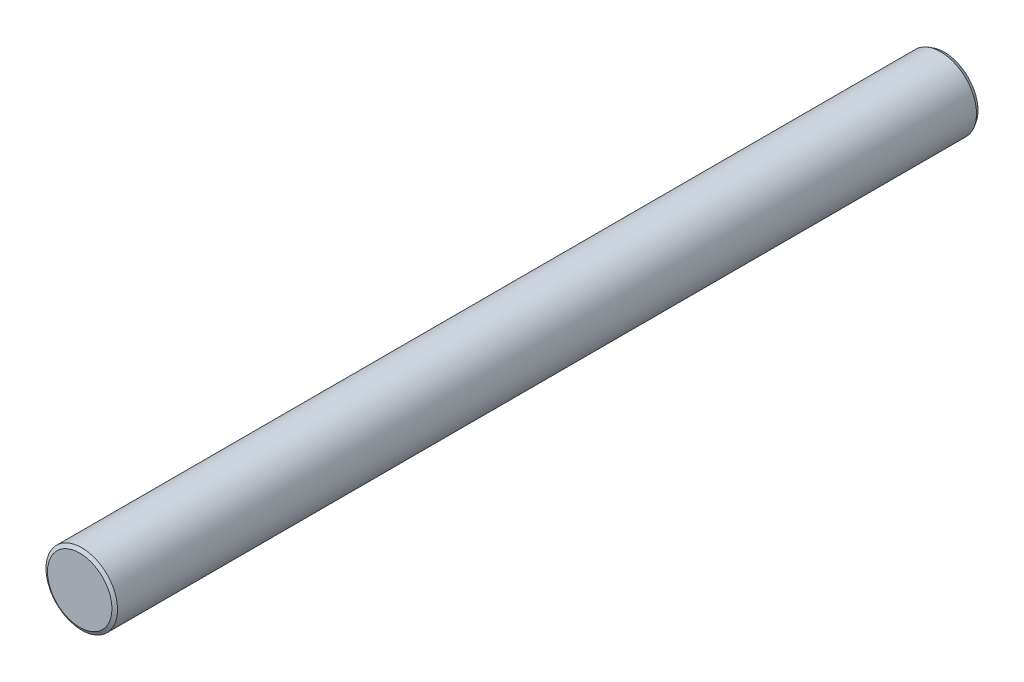
from build123d import *
from OCP.BRepFilletAPI import BRepFilletAPI_MakeChamfer

# Parameters (mm, degrees)
SKETCH1_R           = 3.475
BOSS_EXTRUDE1_DEPTH = 42
CHAMFER1_SIZE       = 0.2
CHAMFER1_SIZE2      = 0.346410162


with BuildPart() as part:
    # Sketch1 → Boss-Extrude1 (new, symmetric)
    with BuildSketch(Plane.XY):
        with Locations(Location((0, 0, 0), (0, 0, 180))):
            Circle(SKETCH1_R)
    extrude(amount=BOSS_EXTRUDE1_DEPTH, both=True)

    # Chamfer1: one chamfer whose edges measure the first distance from different faces: ONE call of the kernel's chamfer builder (chamfer() names one face for all edges)
    chamfer1_edges_1 = [part.edges().sort_by_distance(p)[0] for p in [
        (3.475, 0, -42),
    ]]
    chamfer1_side_1 = [part.faces().sort_by_distance(p)[0] for p in [
        (0, 0, -42),
    ]]
    chamfer1_edges_2 = [part.edges().sort_by_distance(p)[0] for p in [
        (3.475, 0, 42),
    ]]
    chamfer1_side_2 = [part.faces().sort_by_distance(p)[0] for p in [
        (3.475, 0, 0),
    ]]
    chamfer1 = BRepFilletAPI_MakeChamfer(part.part.solid().wrapped)
    for e in chamfer1_edges_1:
        chamfer1.Add(CHAMFER1_SIZE, CHAMFER1_SIZE2, e.wrapped, chamfer1_side_1[0].wrapped)  # the first distance lies on this face
    for e in chamfer1_edges_2:
        chamfer1.Add(CHAMFER1_SIZE, CHAMFER1_SIZE2, e.wrapped, chamfer1_side_2[0].wrapped)  # the first distance lies on this face
    add(Compound.cast(chamfer1.Shape()), mode=Mode.REPLACE)


solid = part.part
